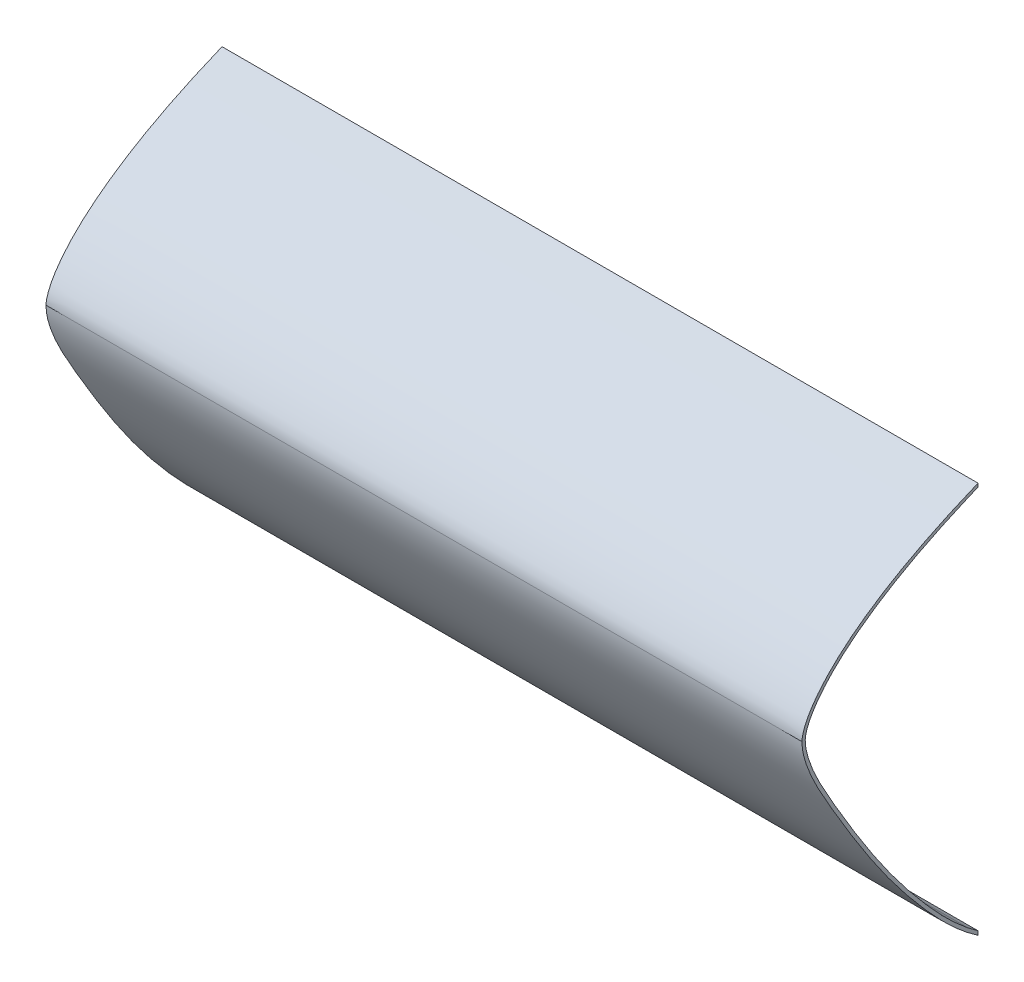
from build123d import *

# Parameters (mm, degrees)
BOSS_EXTRUDE1_DEPTH = 231.775


with BuildPart() as part:
    # Sketch1 → Boss-Extrude1 (new body)
    with BuildSketch(Plane.ZY.offset(-34.925)):
        with BuildLine():
            Line((-53.975, -77.204508027), (-53.975, -78.419412207))
            add(Edge.make_bspline(
                [(0, 0), (-0.017452033, -0.519005663), (-0.06166203, -1.833765907), (-0.570189515, -4.396811557), (-2.53612962, -10.616386462), (-7.9982118, -20.550135555), (-16.1136536, -34.184951823), (-25.751267724, -48.900160958), (-36.932012921, -62.938772264), (-46.457496122, -72.906141172), (-52.583490281, -77.46023067), (-53.975, -78.419412207)],
                knots=[0, 0, 0, 0, 0.001820909, 0.00461278, 0.00913453, 0.024675939, 0.044152768, 0.064937103, 0.086320988, 0.107137618, 0.113056669, 0.113056669, 0.113056669, 0.113056669], degree=3))
            add(Edge.make_bspline(
                [(-53.975, 41.651039403), (-50.709199496, 40.322947817), (-41.673766417, 36.430233183), (-28.158616929, 29.509232905), (-14.871033111, 20.557827015), (-6.144191432, 12.313264357), (-1.948102578, 6.176486601), (-0.639134364, 3.084122633), (-0.217045478, 1.668030347), (-0.042563089, 0.777840261), (-0.010742005, 0.196310087), (0, 0)],
                knots=[0.915751061, 0.915751061, 0.915751061, 0.915751061, 0.928425323, 0.951113046, 0.970252676, 0.985871491, 0.993981784, 0.996752649, 0.997906779, 0.999293381, 1, 1, 1, 1], degree=3))
            Line((-53.975, 41.651039403), (-53.975, 40.570467669))
            add(Edge.make_bspline(
                [(-53.975, 40.570467669), (-52.223886058, 39.855098624), (-46.55545684, 37.466004168), (-37.125856967, 33.052667662), (-27.830126078, 27.881861429), (-20.719091852, 23.242104552), (-15.614495512, 19.455137028), (-10.786663524, 15.322063664), (-6.429543979, 10.752121577), (-3.329781232, 6.520651809), (-1.766394253, 3.289416468), (-1.234579927, 1.629552357), (-1.070917704, 0.808496148), (-1.022680145, 0.373573872), (-1.00777339, 0.114040658), (-1.00092143, -0.010571576)],
                knots=[0.916241011, 0.916241011, 0.916241011, 0.916241011, 0.923068013, 0.938443772, 0.953819531, 0.961507411, 0.96919529, 0.97688317, 0.98457105, 0.992258929, 0.996102869, 0.998024839, 0.998985824, 0.999466316, 0.999946809, 0.999946809, 0.999946809, 0.999946809], degree=3))
            add(Edge.make_bspline(
                [(-1.00092143, -0.010571576), (-1.009923866, -0.277884036), (-1.028927427, -0.823363497), (-1.102768583, -1.825860344), (-1.416760314, -3.597204949), (-2.45215177, -7.203197251), (-4.557690792, -12.131446446), (-7.694252843, -17.87383852), (-12.081452023, -25.466401501), (-17.732189245, -34.79647061), (-24.919919042, -45.768224894), (-31.457640354, -54.481000173), (-37.047635253, -61.18254607), (-42.853610743, -67.720036372), (-48.449554365, -73.119796986), (-52.936471607, -76.472448044), (-53.975, -77.204508027)],
                knots=[5.1727e-05, 5.1727e-05, 5.1727e-05, 5.1727e-05, 0.001013083, 0.00197444, 0.003897153, 0.007742579, 0.015433432, 0.023124285, 0.030815138, 0.046196844, 0.06157855, 0.076960256, 0.084651109, 0.092341962, 0.107723668, 0.112236216, 0.112236216, 0.112236216, 0.112236216], degree=3))
        make_face()
    extrude(amount=-BOSS_EXTRUDE1_DEPTH)


solid = part.part
